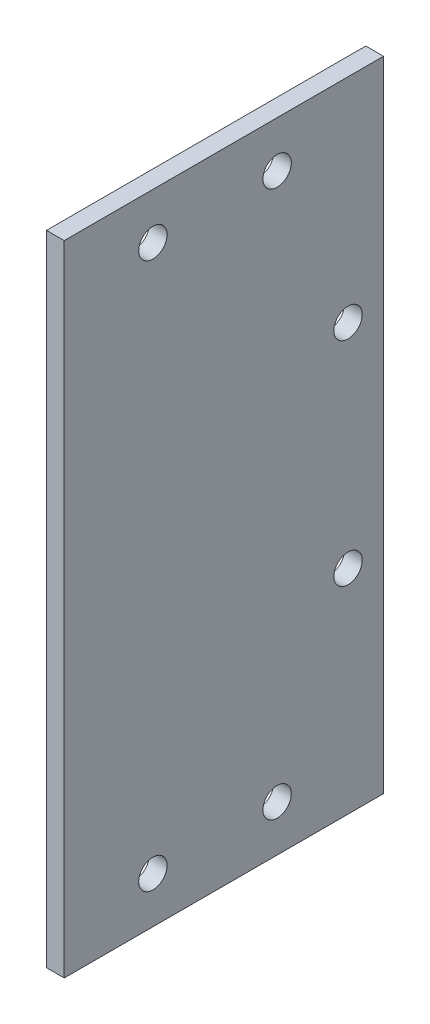
from build123d import *

# Parameters (mm, degrees)
SKETCH1_W           = 180
SKETCH1_H           = 90
SKETCH1_R           = 4
BOSS_EXTRUDE1_DEPTH = 5


with BuildPart() as part:
    # Sketch1 → Boss-Extrude1 (new body)
    with BuildSketch(Plane.YZ):
        Rectangle(SKETCH1_W, SKETCH1_H)
        with Locations(Location((-77, 20, 0), (0, 0, 270))):
            Circle(SKETCH1_R, mode=Mode.SUBTRACT)
        with Locations(Location((-77, -15, 0), (0, 0, 270))):
            Circle(SKETCH1_R, mode=Mode.SUBTRACT)
        with Locations(Location((-30, -35, 0), (0, 0, 270))):
            Circle(SKETCH1_R, mode=Mode.SUBTRACT)
        with Locations(Location((30, -35, 0), (0, 0, 90))):
            Circle(SKETCH1_R, mode=Mode.SUBTRACT)
        with Locations(Location((77, -15, 0), (0, 0, 90))):
            Circle(SKETCH1_R, mode=Mode.SUBTRACT)
        with Locations(Location((77, 20, 0), (0, 0, 90))):
            Circle(SKETCH1_R, mode=Mode.SUBTRACT)
    extrude(amount=BOSS_EXTRUDE1_DEPTH)


solid = part.part
